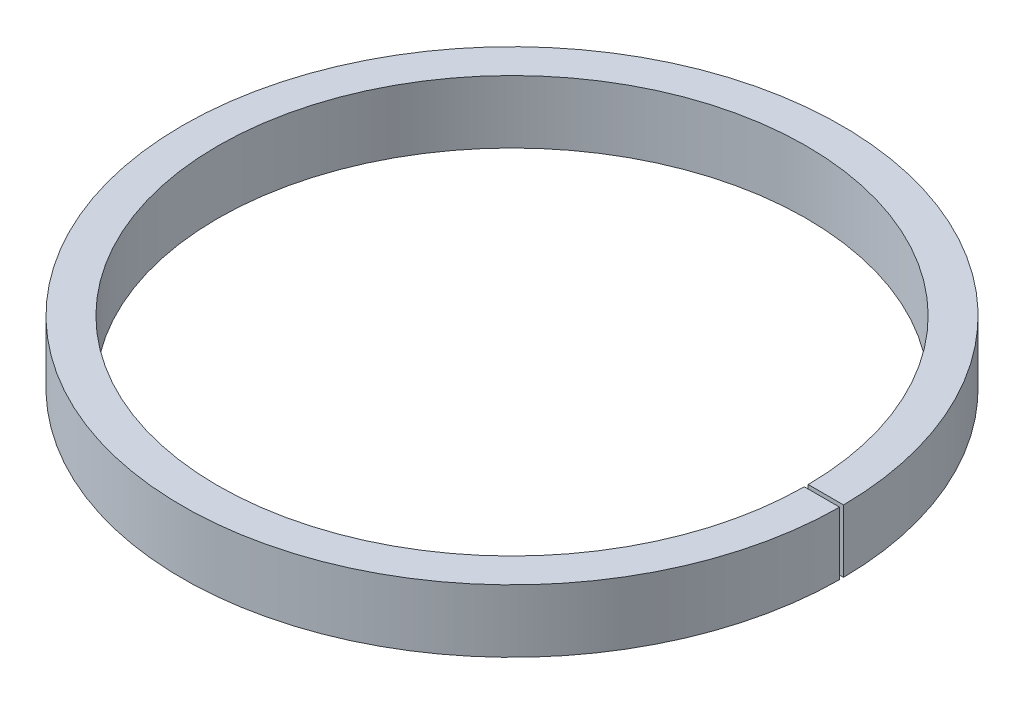
from build123d import *

# Parameters (mm, degrees)
BOSS_EXTRUDE1_DEPTH = 4


with BuildPart() as part:
    # Sketch1 → Boss-Extrude1 (new, symmetric)
    with BuildSketch(Plane(origin=(0, 0, 0), x_dir=(1, 0, 0), z_dir=(0, 1, 0))):
        with BuildLine():
            Line((37.499166657, 0.25), (41.999255946, 0.25))
            ThreePointArc((41.999255946, 0.25), (-42, 0), (41.999255946, -0.25))
            Line((41.999255946, -0.25), (37.499166657, -0.25))
            ThreePointArc((37.499166657, -0.25), (-37.5, 0), (37.499166657, 0.25))
        make_face()
    extrude(amount=BOSS_EXTRUDE1_DEPTH, both=True)


solid = part.part
